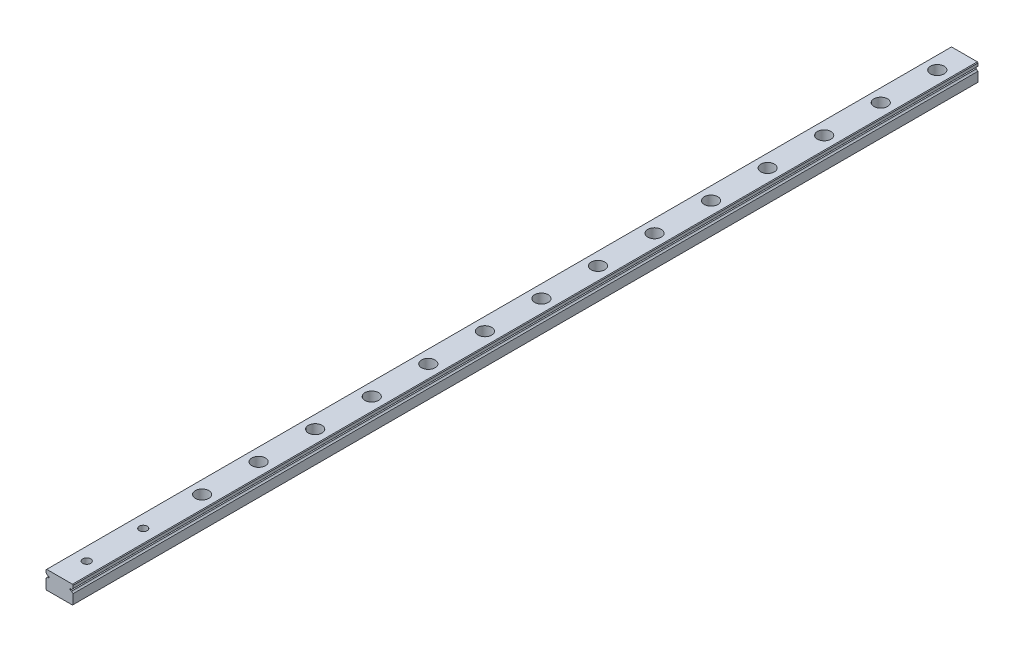
from build123d import *

# Parameters (mm, degrees)
EXTRUDE_1_DEPTH        = 400
SKETCH_2_R             = 3
SKETCH_2_R_2           = 1.75
CUT_EXTRUDE_1_DEPTH    = 4.5
SKETCH_2_2_R           = 1.75
CUT_EXTRUDE_2_DEPTH    = 401.124980475
PATTERN_LINEAR_1_COUNT = 14
PATTERN_LINEAR_1_PITCH = 25
CROQUIS1_R             = 1.75
CORTAR_EXTRUIR1_DEPTH  = 8


with BuildPart() as part:
    # Эскиз1 → Бобышка-Вытянуть1 (new body)
    with BuildSketch(Plane.XY):
        with BuildLine():
            Line((-6, 3.7), (-5.7, 4))
            Line((-5.7, 4), (5.7, 4))
            Line((5.7, 4), (6, 3.7))
            Line((6, 3.7), (6, 2.451013544))
            ThreePointArc((6, 2.451013544), (5.597935912, 2.202976267), (5.354599002, 1.798050138))
            Line((5.354599002, 1.798050138), (4.643514056, 1.798050138))
            Line((4.643514056, 1.798050138), (4.643514056, 1.201949862))
            Line((4.643514056, 1.201949862), (5.354599002, 1.201949862))
            ThreePointArc((5.354599002, 1.201949862), (5.597935912, 0.797023733), (6, 0.548986456))
            Line((6, 0.548986456), (6, -3.7))
            Line((6, -3.7), (5.7, -4))
            Line((5.7, -4), (-5.7, -4))
            Line((-5.7, -4), (-6, -3.7))
            Line((-6, -3.7), (-6, 0.548986456))
            ThreePointArc((-6, 0.548986456), (-5.597935912, 0.797023733), (-5.354599002, 1.201949862))
            Line((-5.354599002, 1.201949862), (-4.643514056, 1.201949862))
            Line((-4.643514056, 1.201949862), (-4.643514056, 1.798050138))
            Line((-4.643514056, 1.798050138), (-5.354599002, 1.798050138))
            ThreePointArc((-5.354599002, 1.798050138), (-5.597935912, 2.202976267), (-6, 2.451013544))
            Line((-6, 2.451013544), (-6, 3.7))
        make_face()
    extrude(amount=EXTRUDE_1_DEPTH)

    # Эскиз2 → Вырез-Вытянуть1 (cut)
    with BuildSketch(Plane(origin=(0, 4, 0), x_dir=(1, 0, 0), z_dir=(0, 1, 0))):
        with Locations(Location((0, -12, 0), (0, 0, 270))):
            Circle(SKETCH_2_R)
        with Locations(Location((0, -12, 0), (0, 0, 270))):
            Circle(SKETCH_2_R_2, mode=Mode.SUBTRACT)
    cut_extrude_1 = extrude(amount=-CUT_EXTRUDE_1_DEPTH, mode=Mode.SUBTRACT)

    # Эскиз2<2> → Вырез-Вытянуть2 (cut, through all)
    with BuildSketch(Plane(origin=(0, 4, 0), x_dir=(1, 0, 0), z_dir=(0, 1, 0))):
        with Locations(Location((0, -12, 0), (0, 0, 270))):
            Circle(SKETCH_2_2_R)
    cut_extrude_2 = extrude(amount=-CUT_EXTRUDE_2_DEPTH, mode=Mode.SUBTRACT)

    # Линейный массив1: Вырез-Вытянуть1, Вырез-Вытянуть2 ×14
    with Locations(*[(0, 0, i * PATTERN_LINEAR_1_PITCH) for i in range(1, PATTERN_LINEAR_1_COUNT)]):
        add(cut_extrude_1, mode=Mode.SUBTRACT)
        add(cut_extrude_2, mode=Mode.SUBTRACT)

    # Croquis1 → Cortar-Extruir1 (cut)
    with BuildSketch(Plane(origin=(0, 4, 0), x_dir=(1, 0, 0), z_dir=(0, 1, 0))):
        with Locations(Location((0, -388, 0), (0, 0, 270))):
            Circle(CROQUIS1_R)
        with Locations(Location((0, -363, 0), (0, 0, 270))):
            Circle(CROQUIS1_R)
    extrude(amount=-CORTAR_EXTRUIR1_DEPTH, mode=Mode.SUBTRACT)


solid = part.part
